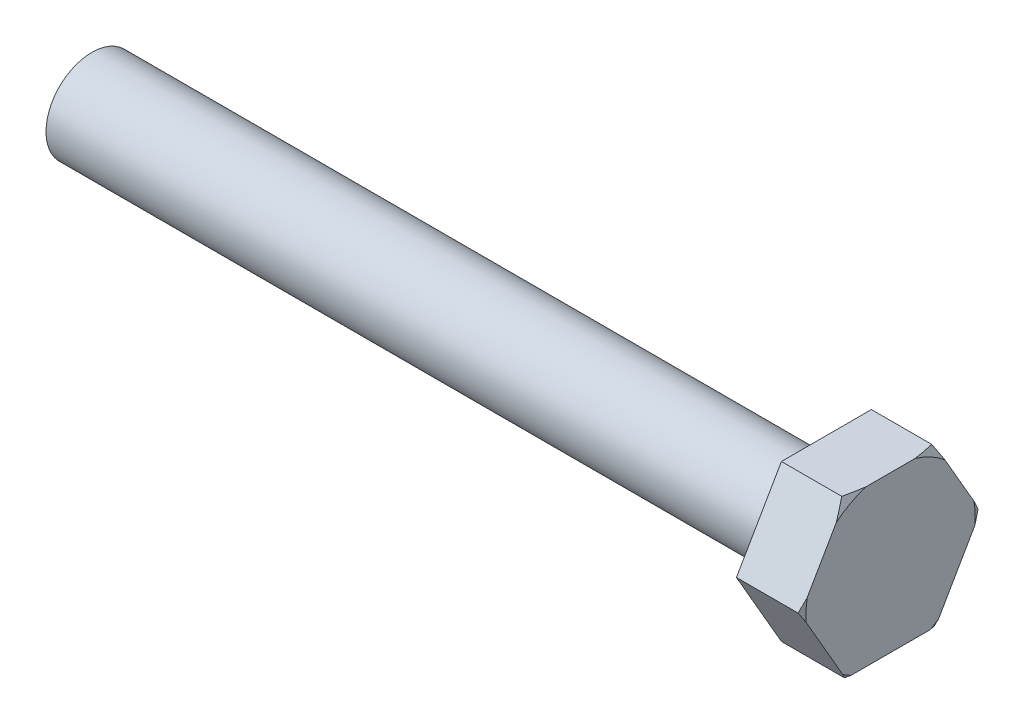
from build123d import *

# Parameters (mm, degrees)
BOSS_EXTRUDE1_DEPTH = 14
SKETCH2_R           = 10
BOSS_EXTRUDE2_DEPTH = 160
DOME1_FACE_RADIUS   = 10
DOME1_HEIGHT        = 3


with BuildPart() as part:
    # Sketch1 → Boss-Extrude1 (new body)
    with BuildSketch(Plane(origin=(0, 0, 0), x_dir=(0, 0, -1), z_dir=(1, 0, 0))):
        Polygon((19.629909152, 0.677446241), (9.814954576, 17.677446241), (-9.814954576, 17.677446241), (-19.629909152, 0.677446241), (-9.814954576, -16.322553759), (9.814954576, -16.322553759), align=None)
    extrude(amount=-BOSS_EXTRUDE1_DEPTH)

    # Sketch2 → Boss-Extrude2 (add)
    with BuildSketch(Plane.ZY.offset(14)):
        with Locations((0.23707655, 0.179585486)):
            Circle(SKETCH2_R)
    extrude(amount=BOSS_EXTRUDE2_DEPTH)

    # Dome1: a dome of height H over a round flat face of radius A is a cap of a sphere of radius (A * A + H * H) / (2 * H)
    dome1_r = (DOME1_FACE_RADIUS * DOME1_FACE_RADIUS + DOME1_HEIGHT * DOME1_HEIGHT) / (2 * DOME1_HEIGHT)
    dome1_base = Plane((-174, 0.179585486, 0.23707655), z_dir=(-1, 0, 0))
    with Locations(dome1_base.offset(DOME1_HEIGHT - dome1_r)):
        dome1_ball = Sphere(dome1_r, mode=Mode.PRIVATE)
    add(split(dome1_ball, bisect_by=dome1_base, keep=Keep.TOP, mode=Mode.PRIVATE))

    # Sketch4 → Cut-Revolve4 (revolve, cut)
    with BuildSketch(Plane(origin=(0, 0, 0), x_dir=(1, 0, 0), z_dir=(0, 1, 0))):
        Polygon((0, 18.463333515), (-1.632693956, 21.873968697), (3.881125963, 21.268551199), (2.875714826, 18.463333515), align=None)
    revolve(axis=Axis((0, 0, 0), (1, 0, 0)), mode=Mode.SUBTRACT)


solid = part.part
